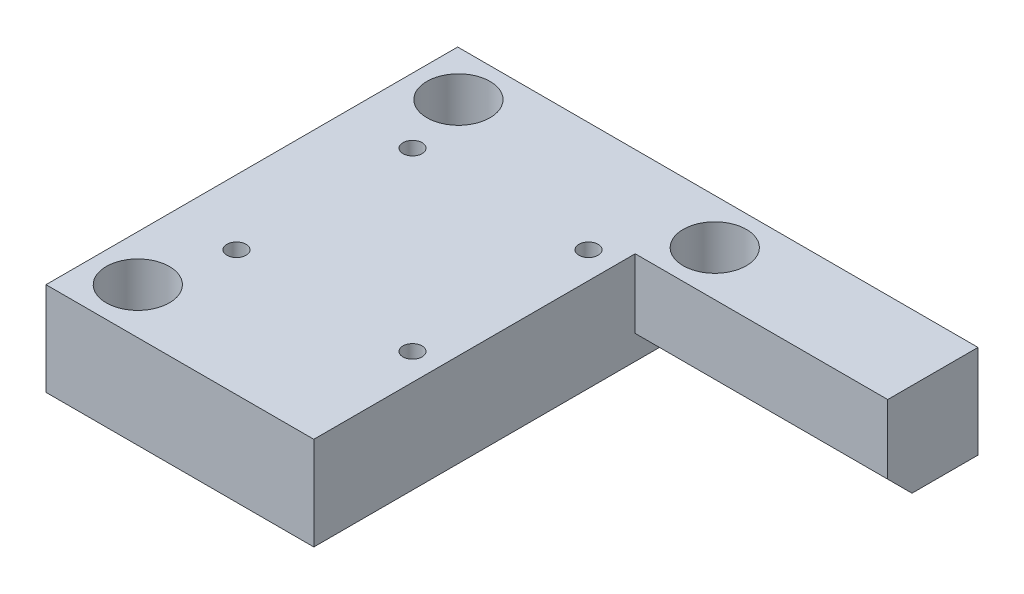
from build123d import *

# Parameters (mm, degrees)
SKETCH1_W           = 68
SKETCH1_H           = 12.192
BOSS_EXTRUDE1_DEPTH = 11.8
SKETCH2_R           = 2.25
CUT_EXTRUDE1_DEPTH  = 71.084840472
SKETCH3_R           = 4.125
CUT_EXTRUDE2_DEPTH  = 7
SKETCH4_W           = 35
SKETCH4_H           = 12.192
BOSS_EXTRUDE2_DEPTH = 42
SKETCH5_R           = 2.25
CUT_EXTRUDE3_DEPTH  = 88.56189162
SKETCH6_R           = 4.125
CUT_EXTRUDE4_DEPTH  = 7
CUT_EXTRUDE5_REACH  = 89.562
SKETCH7_R           = 1.25
CHAMFER1_SIZE       = 3.175


with BuildPart() as part:
    # Sketch1 → Boss-Extrude1 (new body)
    with BuildSketch(Plane.XY):
        with Locations((34, -6.096)):
            Rectangle(SKETCH1_W, SKETCH1_H)
    extrude(amount=BOSS_EXTRUDE1_DEPTH)

    # Sketch2 → Cut-Extrude1 (cut, through all)
    with BuildSketch(Plane(origin=(0, 0, 0), x_dir=(1, 0, 0), z_dir=(0, 1, 0))):
        with Locations(Location((39.5, -5.9, 0), (0, 0, 270))):
            Circle(SKETCH2_R)
        with Locations(Location((6, -5.9, 0), (0, 0, 270))):
            Circle(SKETCH2_R)
    extrude(amount=-CUT_EXTRUDE1_DEPTH, mode=Mode.SUBTRACT)

    # Sketch3 → Cut-Extrude2 (cut)
    with BuildSketch(Plane(origin=(0, 0, 0), x_dir=(1, 0, 0), z_dir=(0, 1, 0))):
        with Locations(Location((39.5, -5.9, 0), (0, 0, 270))):
            Circle(SKETCH3_R)
        with Locations(Location((6, -5.9, 0), (0, 0, 270))):
            Circle(SKETCH3_R)
    extrude(amount=-CUT_EXTRUDE2_DEPTH, mode=Mode.SUBTRACT)

    # Sketch4 → Boss-Extrude2 (add)
    with BuildSketch(Plane.XY.offset(11.8)):
        with Locations((17.5, -6.096)):
            Rectangle(SKETCH4_W, SKETCH4_H)
    extrude(amount=BOSS_EXTRUDE2_DEPTH)

    # Sketch5 → Cut-Extrude3 (cut, through all)
    with BuildSketch(Plane(origin=(0, 0, 0), x_dir=(1, 0, 0), z_dir=(0, 1, 0))):
        with Locations(Location((6, -47.8, 0), (0, 0, 270))):
            Circle(SKETCH5_R)
    extrude(amount=-CUT_EXTRUDE3_DEPTH, mode=Mode.SUBTRACT)

    # Sketch6 → Cut-Extrude4 (cut)
    with BuildSketch(Plane(origin=(0, 0, 0), x_dir=(1, 0, 0), z_dir=(0, 1, 0))):
        with Locations(Location((6, -47.8, 0), (0, 0, 270))):
            Circle(SKETCH6_R)
    extrude(amount=-CUT_EXTRUDE4_DEPTH, mode=Mode.SUBTRACT)

    # Sketch7 → Cut-Extrude5 (cut, up to next)
    with BuildSketch(Plane(origin=(0, 0, 0), x_dir=(1, 0, 0), z_dir=(0, 1, 0)), mode=Mode.PRIVATE) as cut_extrude5_sk1:
        with Locations(Location((8.5, -14.400241512, 0), (0, 0, 270))):
            Circle(SKETCH7_R)
    cut_extrude5_tool1 = extrude(cut_extrude5_sk1.sketch, amount=-CUT_EXTRUDE5_REACH, mode=Mode.PRIVATE) & part.part
    # Sketch7 → Cut-Extrude5 (cut, up to next)
    with BuildSketch(Plane(origin=(0, 0, 0), x_dir=(1, 0, 0), z_dir=(0, 1, 0)), mode=Mode.PRIVATE) as cut_extrude5_sk2:
        with Locations(Location((8.497816512, -37.402425, 0), (0, 0, 270))):
            Circle(SKETCH7_R)
    cut_extrude5_tool2 = extrude(cut_extrude5_sk2.sketch, amount=-CUT_EXTRUDE5_REACH, mode=Mode.PRIVATE) & part.part
    # Sketch7 → Cut-Extrude5 (cut, up to next)
    with BuildSketch(Plane(origin=(0, 0, 0), x_dir=(1, 0, 0), z_dir=(0, 1, 0)), mode=Mode.PRIVATE) as cut_extrude5_sk3:
        with Locations(Location((31.5, -37.404608488, 0), (0, 0, 270))):
            Circle(SKETCH7_R)
    cut_extrude5_tool3 = extrude(cut_extrude5_sk3.sketch, amount=-CUT_EXTRUDE5_REACH, mode=Mode.PRIVATE) & part.part
    # Sketch7 → Cut-Extrude5 (cut, up to next)
    with BuildSketch(Plane(origin=(0, 0, 0), x_dir=(1, 0, 0), z_dir=(0, 1, 0)), mode=Mode.PRIVATE) as cut_extrude5_sk4:
        with Locations(Location((31.502183488, -14.402425, 0), (0, 0, 270))):
            Circle(SKETCH7_R)
    cut_extrude5_tool4 = extrude(cut_extrude5_sk4.sketch, amount=-CUT_EXTRUDE5_REACH, mode=Mode.PRIVATE) & part.part
    add(cut_extrude5_tool1.solids().sort_by_distance((8.5, 0, 14.400242))[0], mode=Mode.SUBTRACT)
    add(cut_extrude5_tool2.solids().sort_by_distance((8.497817, 0, 37.402425))[0], mode=Mode.SUBTRACT)
    add(cut_extrude5_tool3.solids().sort_by_distance((31.5, 0, 37.404608))[0], mode=Mode.SUBTRACT)
    add(cut_extrude5_tool4.solids().sort_by_distance((31.502183, 0, 14.402425))[0], mode=Mode.SUBTRACT)

    # Chamfer1
    chamfer1_edges = [part.edges().sort_by_distance(p)[0] for p in [
        (51.5, -12.192, 11.8),
    ]]
    chamfer(chamfer1_edges, length=CHAMFER1_SIZE)


solid = part.part
